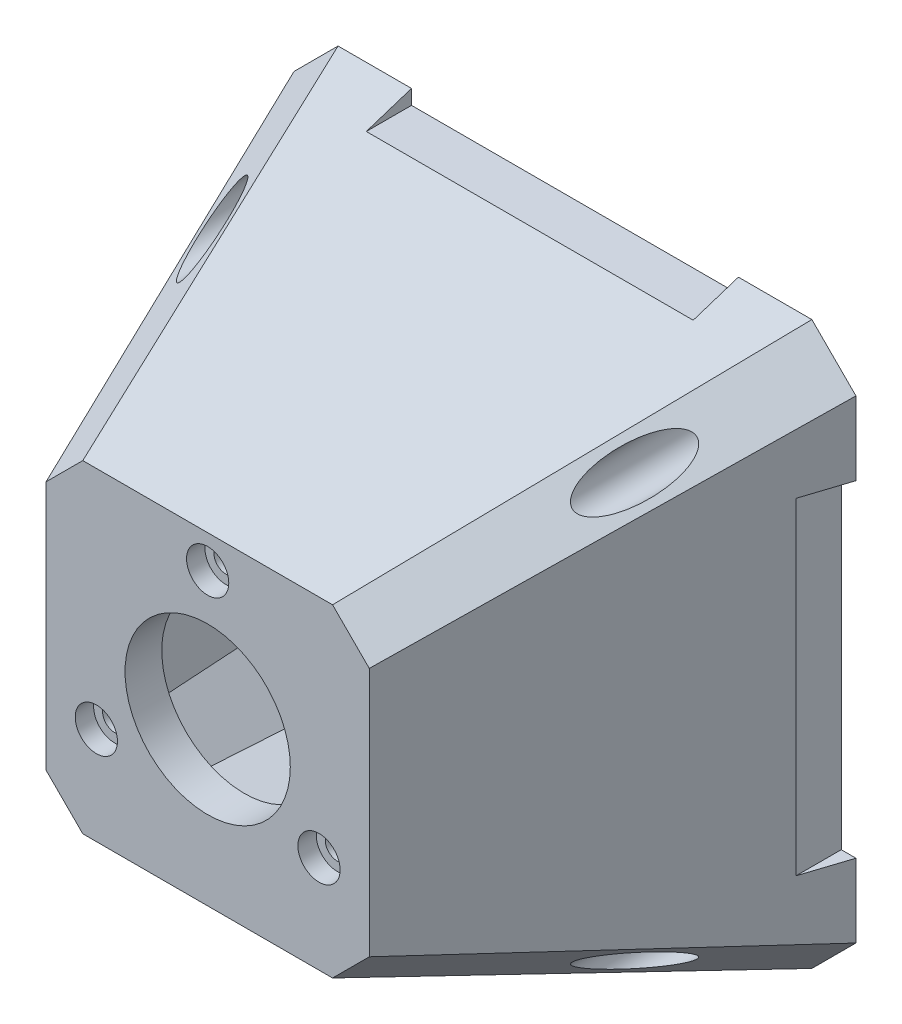
from build123d import *

# Parameters (mm, degrees)
SKETCH3_R           = 1.65
CUT_EXTRUDE1_DEPTH  = 50
SKETCH4_R           = 2.875
CUT_EXTRUDE2_DEPTH  = 47.5
SKETCH5_R           = 11.25
CUT_EXTRUDE3_DEPTH  = 74.662236087
CUT_EXTRUDE4_REACH  = 75.662
SKETCH6_W           = 44.5
SKETCH6_H           = 2
SKETCH6_W_2         = 2
SKETCH6_H_2         = 44.5
CUT_EXTRUDE6_REACH  = 75.662
SKETCH9_R           = 1.65
SKETCH11_R          = 22.5
CUT_EXTRUDE8_DEPTH  = 5
BOSS_EXTRUDE2_DEPTH = 4.9
SKETCH13_R          = 2.875
CUT_EXTRUDE9_DEPTH  = 2.5
CIRPATTERN1_COUNT   = 3


with BuildPart() as part:
    # Sketch2 → Loft2 section 0
    with BuildSketch(Plane.XY.offset(50)):
        with BuildLine():
            Line((-17, -22), (17, -22))
            Line((17, -22), (22, -17))
            Line((22, -17), (22, 17))
            Line((22, 17), (17, 22))
            Line((17, 22), (-17, 22))
            Line((-17, 22), (-22, 17))
            Line((-22, 17), (-22, -17))
            Line((-22, -17), (-17, -22))
        make_face()
    # Sketch1 → Loft2 section 1
    with BuildSketch(Plane.XY):
        with BuildLine():
            Line((38.25, 32.25), (32.25, 38.25))
            Line((32.25, 38.25), (-32.25, 38.25))
            Line((-32.25, 38.25), (-38.25, 32.25))
            Line((-38.25, 32.25), (-38.25, -32.25))
            Line((-38.25, -32.25), (-32.25, -38.25))
            Line((-32.25, -38.25), (32.25, -38.25))
            Line((32.25, -38.25), (38.25, -32.25))
            Line((38.25, -32.25), (38.25, 32.25))
        make_face()
    loft()

    # Sketch3 → Cut-Extrude1 (cut)
    with BuildSketch(Plane(origin=(0, 0, 0), x_dir=(-1, 0, 0), z_dir=(0, 0, -1))):
        with Locations((-28.75, 28.75)):
            Circle(SKETCH3_R)
        with Locations(Location((28.75, 28.75, 0), (0, 0, 45))):
            Circle(SKETCH3_R)
        with Locations((28.75, -28.75)):
            Circle(SKETCH3_R)
        with Locations(Location((-28.75, -28.75, 0), (0, 0, 225))):
            Circle(SKETCH3_R)
    extrude(amount=-CUT_EXTRUDE1_DEPTH, mode=Mode.SUBTRACT)

    # Sketch4 → Cut-Extrude2 (cut)
    with BuildSketch(Plane.XY.offset(50)):
        with Locations((-28.75, 28.75)):
            Circle(SKETCH4_R)
        with Locations((28.75, 28.75)):
            Circle(SKETCH4_R)
        with Locations((28.75, -28.75)):
            Circle(SKETCH4_R)
        with Locations((-28.75, -28.75)):
            Circle(SKETCH4_R)
    extrude(amount=-CUT_EXTRUDE2_DEPTH, mode=Mode.SUBTRACT)

    # Sketch5 → Cut-Extrude3 (cut, through all)
    with BuildSketch(Plane.XY.offset(50)):
        Circle(SKETCH5_R)
    extrude(amount=-CUT_EXTRUDE3_DEPTH, mode=Mode.SUBTRACT)

    # Sketch6 → Cut-Extrude4 (cut, up to next)
    with BuildSketch(Plane(origin=(0, 0, 0), x_dir=(-1, 0, 0), z_dir=(0, 0, -1)), mode=Mode.PRIVATE) as cut_extrude4_sk1:
        with Locations((0, 37.25)):
            Rectangle(SKETCH6_W, SKETCH6_H)
    cut_extrude4_tool1 = extrude(cut_extrude4_sk1.sketch, amount=-CUT_EXTRUDE4_REACH, mode=Mode.PRIVATE) & part.part
    # Sketch6 → Cut-Extrude4 (cut, up to next)
    with BuildSketch(Plane(origin=(0, 0, 0), x_dir=(-1, 0, 0), z_dir=(0, 0, -1)), mode=Mode.PRIVATE) as cut_extrude4_sk2:
        with Locations((37.25, 0)):
            Rectangle(SKETCH6_W_2, SKETCH6_H_2)
    cut_extrude4_tool2 = extrude(cut_extrude4_sk2.sketch, amount=-CUT_EXTRUDE4_REACH, mode=Mode.PRIVATE) & part.part
    # Sketch6 → Cut-Extrude4 (cut, up to next)
    with BuildSketch(Plane(origin=(0, 0, 0), x_dir=(-1, 0, 0), z_dir=(0, 0, -1)), mode=Mode.PRIVATE) as cut_extrude4_sk3:
        with Locations((0, -37.25)):
            Rectangle(SKETCH6_W, SKETCH6_H)
    cut_extrude4_tool3 = extrude(cut_extrude4_sk3.sketch, amount=-CUT_EXTRUDE4_REACH, mode=Mode.PRIVATE) & part.part
    # Sketch6 → Cut-Extrude4 (cut, up to next)
    with BuildSketch(Plane(origin=(0, 0, 0), x_dir=(-1, 0, 0), z_dir=(0, 0, -1)), mode=Mode.PRIVATE) as cut_extrude4_sk4:
        with Locations((-37.25, 0)):
            Rectangle(SKETCH6_W_2, SKETCH6_H_2)
    cut_extrude4_tool4 = extrude(cut_extrude4_sk4.sketch, amount=-CUT_EXTRUDE4_REACH, mode=Mode.PRIVATE) & part.part
    add(cut_extrude4_tool1.solids().sort_by_distance((0, 37.25, 0))[0], mode=Mode.SUBTRACT)
    add(cut_extrude4_tool2.solids().sort_by_distance((-37.25, 0, 0))[0], mode=Mode.SUBTRACT)
    add(cut_extrude4_tool3.solids().sort_by_distance((0, -37.25, 0))[0], mode=Mode.SUBTRACT)
    add(cut_extrude4_tool4.solids().sort_by_distance((37.25, 0, 0))[0], mode=Mode.SUBTRACT)

    # Sketch8 → Cut-Loft2 section 0
    with BuildSketch(Plane.XY.offset(45)):
        with BuildLine():
            Line((22, -17), (22, 17))
            Line((22, 17), (17, 22))
            Line((17, 22), (-17, 22))
            Line((-17, 22), (-22, 17))
            Line((-22, 17), (-22, -17))
            Line((-22, -17), (-17, -22))
            Line((-17, -22), (17, -22))
            Line((17, -22), (22, -17))
        make_face()
    # Sketch7 → Cut-Loft2 section 1
    with BuildSketch(Plane(origin=(0, 0, 0), x_dir=(-1, 0, 0), z_dir=(0, 0, -1))):
        with BuildLine():
            Line((18.863961031, -26.5), (26.5, -18.863961031))
            Line((26.5, -18.863961031), (26.5, 18.863961031))
            Line((26.5, 18.863961031), (18.863961031, 26.5))
            Line((18.863961031, 26.5), (-18.863961031, 26.5))
            Line((-18.863961031, 26.5), (-26.5, 18.863961031))
            Line((-26.5, 18.863961031), (-26.5, -18.863961031))
            Line((-26.5, -18.863961031), (-18.863961031, -26.5))
            Line((-18.863961031, -26.5), (18.863961031, -26.5))
        make_face()
    loft(mode=Mode.SUBTRACT)

    # Sketch9 → Cut-Extrude6 (cut, up to next)
    with BuildSketch(Plane.XY.offset(50), mode=Mode.PRIVATE) as cut_extrude6_sk1:
        with Locations((0, 17.5)):
            Circle(SKETCH9_R)
    cut_extrude6_tool1 = extrude(cut_extrude6_sk1.sketch, amount=-CUT_EXTRUDE6_REACH, mode=Mode.PRIVATE) & part.part
    # Sketch9 → Cut-Extrude6 (cut, up to next)
    with BuildSketch(Plane.XY.offset(50), mode=Mode.PRIVATE) as cut_extrude6_sk2:
        with Locations((15.155444566, -8.75)):
            Circle(SKETCH9_R)
    cut_extrude6_tool2 = extrude(cut_extrude6_sk2.sketch, amount=-CUT_EXTRUDE6_REACH, mode=Mode.PRIVATE) & part.part
    # Sketch9 → Cut-Extrude6 (cut, up to next)
    with BuildSketch(Plane.XY.offset(50), mode=Mode.PRIVATE) as cut_extrude6_sk3:
        with Locations((-15.155444566, -8.75)):
            Circle(SKETCH9_R)
    cut_extrude6_tool3 = extrude(cut_extrude6_sk3.sketch, amount=-CUT_EXTRUDE6_REACH, mode=Mode.PRIVATE) & part.part
    add(cut_extrude6_tool1.solids().sort_by_distance((0, 17.5, 50))[0], mode=Mode.SUBTRACT)
    add(cut_extrude6_tool2.solids().sort_by_distance((15.155445, -8.75, 50))[0], mode=Mode.SUBTRACT)
    add(cut_extrude6_tool3.solids().sort_by_distance((-15.155445, -8.75, 50))[0], mode=Mode.SUBTRACT)

    # Sketch11 → Cut-Extrude8 (cut)
    with BuildSketch(Plane(origin=(0, 0, 45), x_dir=(-1, 0, 0), z_dir=(0, 0, -1))):
        Circle(SKETCH11_R)
    extrude(amount=CUT_EXTRUDE8_DEPTH, mode=Mode.SUBTRACT)

    # Sketch12 → Boss-Extrude2 (add)
    with BuildSketch(Plane(origin=(0, 0, 45), x_dir=(-1, 0, 0), z_dir=(0, 0, -1))):
        with BuildLine():
            Line((-22, 4.716990566), (-22, 17))
            Line((-22, 17), (-17, 22))
            Line((-17, 22), (-4.716990566, 22))
            ThreePointArc((-4.716990566, 22), (-15.909902577, 15.909902577), (-22, 4.716990566))
        make_face()
        with BuildLine():
            Line((17, 22), (22, 17))
            Line((22, 17), (22, 4.716990566))
            ThreePointArc((22, 4.716990566), (15.909902577, 15.909902577), (4.716990566, 22))
            Line((4.716990566, 22), (17, 22))
        make_face()
        with BuildLine():
            Line((22, -17), (17, -22))
            Line((17, -22), (4.716990566, -22))
            ThreePointArc((4.716990566, -22), (15.909902577, -15.909902577), (22, -4.716990566))
            Line((22, -4.716990566), (22, -17))
        make_face()
        with BuildLine():
            Line((-17, -22), (-22, -17))
            Line((-22, -17), (-22, -4.716990566))
            ThreePointArc((-22, -4.716990566), (-15.909902577, -15.909902577), (-4.716990566, -22))
            Line((-4.716990566, -22), (-17, -22))
        make_face()
    extrude(amount=BOSS_EXTRUDE2_DEPTH)

    # Sketch13 → Cut-Extrude9 (cut)
    with BuildSketch(Plane.XY.offset(50)):
        with Locations((0, 17.5)):
            Circle(SKETCH13_R)
    cut_extrude9 = extrude(amount=-CUT_EXTRUDE9_DEPTH, mode=Mode.SUBTRACT)

    # CirPattern1: Cut-Extrude9 ×3 about axis
    cirpattern1_axis = Axis((0, 0, 0), (0, 0, 1))
    for i in range(1, CIRPATTERN1_COUNT):
        add(cut_extrude9.rotate(cirpattern1_axis, i * 360 / CIRPATTERN1_COUNT), mode=Mode.SUBTRACT)


solid = part.part
